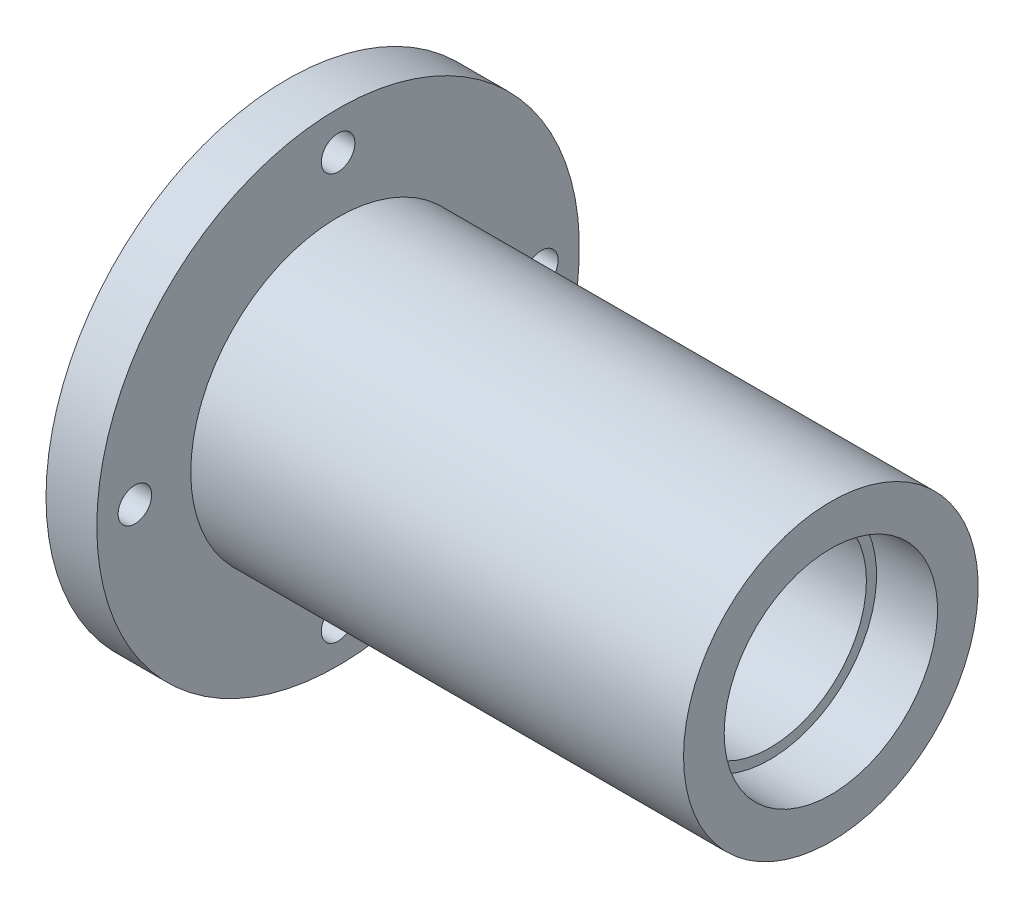
from build123d import *

# Parameters (mm, degrees)
PER_AGE1_D = 6.6


with BuildPart() as part:
    # Esquisse1 → Base-Révolution (revolve)
    with BuildSketch(Plane.XY, mode=Mode.PRIVATE) as base_r_volution_sk:
        Polygon((0, 22.5), (0, 30), (3, 30), (3, 47.5), (13, 47.5), (13, 29), (110, 29), (110, 21), (98, 21), (98, 19), (32, 19), (32, 21), (20, 21), (20, 22.5), align=None)
    revolve(base_r_volution_sk.sketch.rotate(Axis((-23.254623921, 0, 0), (1, 0, 0)), 90), axis=Axis((-23.254623921, 0, 0), (1, 0, 0)))

    # Perçage1 (through all)
    with Locations(Plane.ZY.offset(-3)):
        with Locations((0, 40), (40, 0), (-40, 0), (0, -40)):
            Hole(PER_AGE1_D / 2)


solid = part.part
